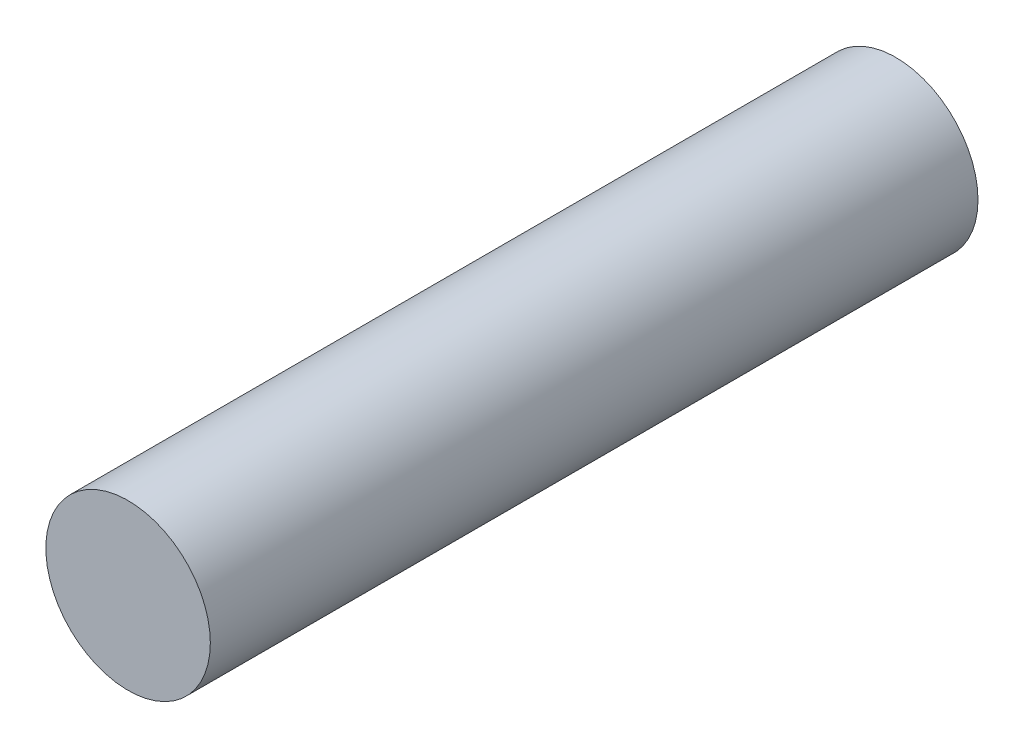
from build123d import *

# Parameters (mm, degrees)
SKETCH1_R           = 7.5
BOSS_EXTRUDE1_DEPTH = 70


with BuildPart() as part:
    # Sketch1 → Boss-Extrude1 (new body)
    with BuildSketch(Plane.XY):
        Circle(SKETCH1_R)
    extrude(amount=BOSS_EXTRUDE1_DEPTH)


solid = part.part
